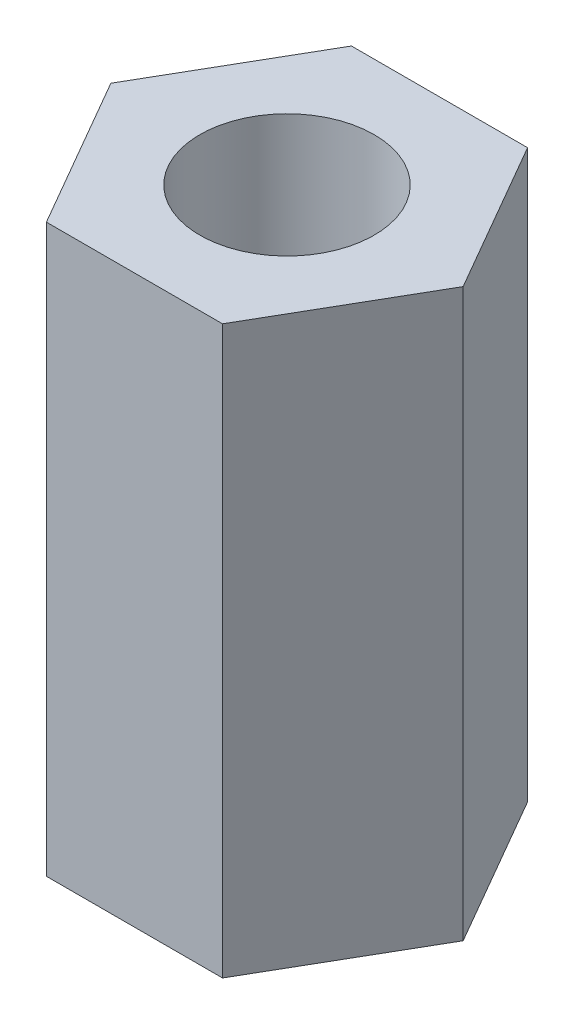
from build123d import *

# Parameters (mm, degrees)
SKETCH1_R           = 2
BOSS_EXTRUDE1_DEPTH = 13


with BuildPart() as part:
    # Sketch1 → Boss-Extrude1 (new body)
    with BuildSketch(Plane(origin=(0, 0, 0), x_dir=(1, 0, 0), z_dir=(0, 1, 0))):
        Polygon((2.020725942, 3.5), (-2.020725942, 3.5), (-4.041451884, 0), (-2.020725942, -3.5), (2.020725942, -3.5), (4.041451884, 0), align=None)
        with Locations(Location((0, 0, 0), (0, 0, 90))):
            Circle(SKETCH1_R, mode=Mode.SUBTRACT)
    extrude(amount=BOSS_EXTRUDE1_DEPTH)


solid = part.part
